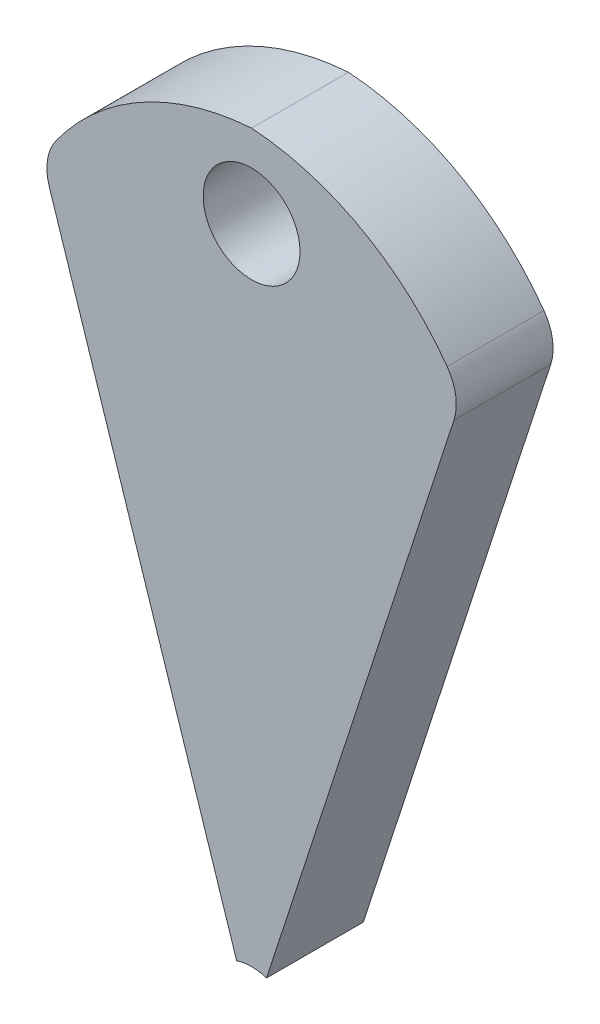
from build123d import *

# Parameters (mm, degrees)
SKETCH1_R           = 50
BOSS_EXTRUDE1_DEPTH = 100
SKETCH3_R           = 15
BOSS_EXTRUDE2_DEPTH = 100
ECHELLE1_SCALE      = 0.075


with BuildPart() as part:
    # Sketch1 → Boss-Extrude1 (new body)
    with BuildSketch(Plane.XY):
        with BuildLine():
            Line((15.450849719, 47.552825815), (208.963323447, 643.122980447))
            ThreePointArc((208.963323447, 643.122980447), (210.809153806, 666.305115195), (201.968702079, 687.814761274))
            ThreePointArc((201.968702079, 687.814761274), (113.501706094, 766.442555341), (0, 800))
            ThreePointArc((0, 800), (-113.501706094, 766.442555341), (-201.968702079, 687.814761274))
            ThreePointArc((-201.968702079, 687.814761274), (-210.809153806, 666.305115195), (-208.963323447, 643.122980447))
            Line((-208.963323447, 643.122980447), (-15.450849719, 47.552825815))
            ThreePointArc((-15.450849719, 47.552825815), (0, 50), (15.450849719, 47.552825815))
        make_face()
        with Locations((0, 714.39)):
            Circle(SKETCH1_R, mode=Mode.SUBTRACT)
    extrude(amount=BOSS_EXTRUDE1_DEPTH)

    # Sketch3 → Boss-Extrude2 (add)
    with BuildSketch(Plane.XY):
        with Locations((0, 630)):
            Circle(SKETCH3_R)
    extrude(amount=-BOSS_EXTRUDE2_DEPTH)


with BuildPart() as part_1:
    # Echelle1: scaled about (0, 496.714078895, 49.597985562)
    add(part.part.scale(ECHELLE1_SCALE).moved(Location((0, 459.460522978, 45.878136645))))


solid = part_1.part
